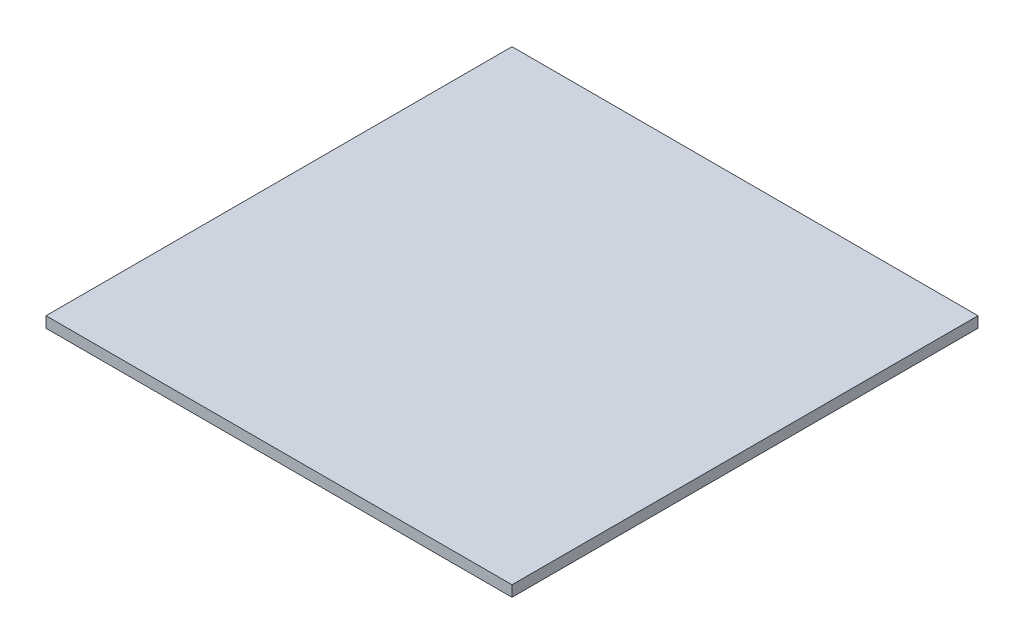
from build123d import *

# Parameters (mm, degrees)
SKETCH1_W           = 214
SKETCH1_H           = 214
BOSS_EXTRUDE1_DEPTH = 5


with BuildPart() as part:
    # Sketch1 → Boss-Extrude1 (new body)
    with BuildSketch(Plane(origin=(0, 0, 0), x_dir=(1, 0, 0), z_dir=(0, 1, 0))):
        Rectangle(SKETCH1_W, SKETCH1_H)
    extrude(amount=BOSS_EXTRUDE1_DEPTH)


solid = part.part
